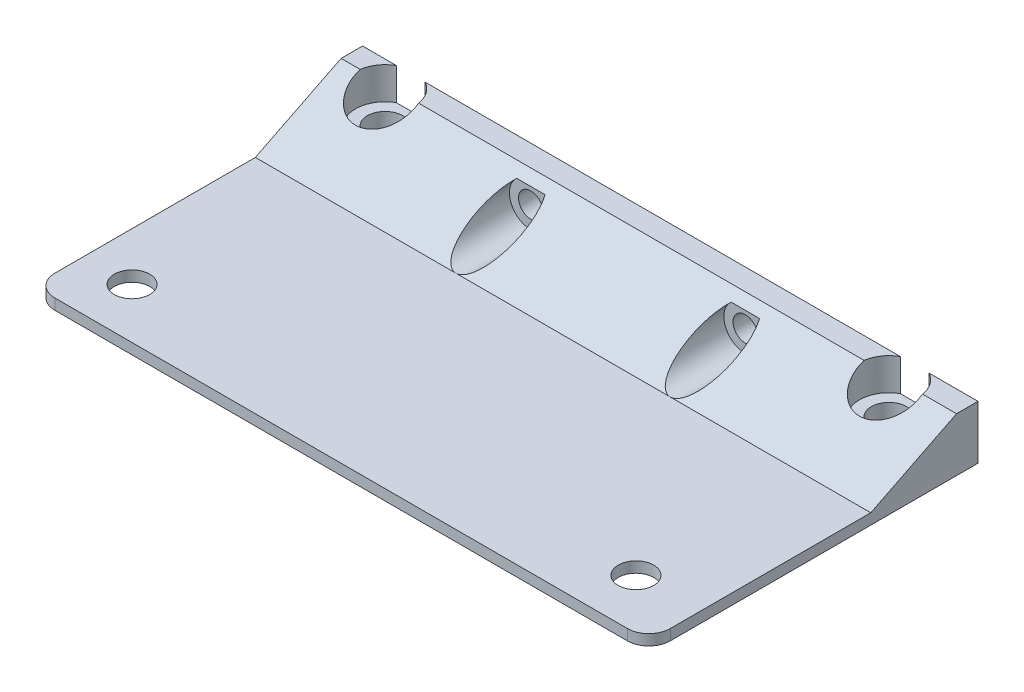
from build123d import *

# Parameters (mm, degrees)
SKETCH1_W           = 57.4
SKETCH1_H           = 33
SKETCH1_R           = 1.65
BOSS_EXTRUDE1_DEPTH = 1
CUT_EXTRUDE1_REACH  = 68.218
SKETCH2_W           = 57.4
SKETCH2_H           = 2.3
BOSS_EXTRUDE2_DEPTH = 57.4
FILLET1_R           = 2
SKETCH4_R           = 1.65
CUT_EXTRUDE2_DEPTH  = 2
CUT_EXTRUDE3_REACH  = 67.163
SKETCH5_R           = 2.75
SKETCH6_R           = 1.15
CUT_EXTRUDE4_DEPTH  = 3
SKETCH9_R           = 2
CUT_EXTRUDE5_DEPTH  = 64.930039887


with BuildPart() as part:
    # Sketch1 → Boss-Extrude1 (new body)
    with BuildSketch(Plane(origin=(0, 0, 0), x_dir=(1, 0, 0), z_dir=(0, 1, 0))):
        with Locations((28.7, 16.5)):
            Rectangle(SKETCH1_W, SKETCH1_H)
        with Locations(Location((4.5, 28.3, 0), (0, 0, 270))):
            Circle(SKETCH1_R, mode=Mode.SUBTRACT)
        with Locations(Location((51.5, 28.3, 0), (0, 0, 270))):
            Circle(SKETCH1_R, mode=Mode.SUBTRACT)
        with Locations(Location((4.5, 4.7, 0), (0, 0, 270))):
            Circle(SKETCH1_R, mode=Mode.SUBTRACT)
        with Locations(Location((51.5, 4.7, 0), (0, 0, 270))):
            Circle(SKETCH1_R, mode=Mode.SUBTRACT)
    extrude(amount=BOSS_EXTRUDE1_DEPTH)

    # Sketch2 → Cut-Extrude1 (cut, up to next)
    with BuildSketch(Plane(origin=(0, 1, 0), x_dir=(1, 0, 0), z_dir=(0, 1, 0)), mode=Mode.PRIVATE) as cut_extrude1_sk1:
        with Locations((28.7, 31.85)):
            Rectangle(SKETCH2_W, SKETCH2_H)
    cut_extrude1_tool1 = extrude(cut_extrude1_sk1.sketch, amount=-CUT_EXTRUDE1_REACH, mode=Mode.PRIVATE) & part.part
    add(cut_extrude1_tool1.solids().sort_by_distance((28.7, 1, -31.85))[0], mode=Mode.SUBTRACT)

    # Sketch3 → Boss-Extrude2 (add)
    with BuildSketch(Plane(origin=(57.4, 0, 0), x_dir=(0, 0, -1), z_dir=(1, 0, 0))):
        Polygon((30.7, 1), (30.7, 5), (28.7, 5), (20.7, 1), align=None)
    extrude(amount=-BOSS_EXTRUDE2_DEPTH)

    # Fillet1
    fillet1_edges = [part.edges().sort_by_distance(p)[0] for p in [
        (57.4, 0.5, 0),
        (0, 0.5, 0),
    ]]
    fillet(fillet1_edges, radius=FILLET1_R)

    # Sketch4 → Cut-Extrude2 (cut)
    with BuildSketch(Plane(origin=(0, 0, 0), x_dir=(-1, 0, 0), z_dir=(0, -1, 0))):
        with Locations(Location((-4.5, 28.3, 0), (0, 0, 90))):
            Circle(SKETCH4_R)
        with Locations(Location((-51.5, 28.3, 0), (0, 0, 90))):
            Circle(SKETCH4_R)
    extrude(amount=-CUT_EXTRUDE2_DEPTH, mode=Mode.SUBTRACT)

    # Sketch5 → Cut-Extrude3 (cut, up to next)
    with BuildSketch(Plane(origin=(0, 2, 0), x_dir=(-1, 0, 0), z_dir=(0, -1, 0)), mode=Mode.PRIVATE) as cut_extrude3_sk1:
        with Locations((-4.5, 28.3)):
            Circle(SKETCH5_R)
    cut_extrude3_tool1 = extrude(cut_extrude3_sk1.sketch, amount=-CUT_EXTRUDE3_REACH, mode=Mode.PRIVATE) & part.part
    # Sketch5 → Cut-Extrude3 (cut, up to next)
    with BuildSketch(Plane(origin=(0, 2, 0), x_dir=(-1, 0, 0), z_dir=(0, -1, 0)), mode=Mode.PRIVATE) as cut_extrude3_sk2:
        with Locations((-51.5, 28.3)):
            Circle(SKETCH5_R)
    cut_extrude3_tool2 = extrude(cut_extrude3_sk2.sketch, amount=-CUT_EXTRUDE3_REACH, mode=Mode.PRIVATE) & part.part
    add(cut_extrude3_tool1.solids().sort_by_distance((4.5, 2, -28.3))[0], mode=Mode.SUBTRACT)
    add(cut_extrude3_tool2.solids().sort_by_distance((51.5, 2, -28.3))[0], mode=Mode.SUBTRACT)

    # Sketch6 → Cut-Extrude4 (cut)
    with BuildSketch(Plane(origin=(0, 0, -30.7), x_dir=(-1, 0, 0), z_dir=(0, 0, -1))):
        with Locations((-38.7, 3)):
            Circle(SKETCH6_R)
        with Locations((-18.7, 3)):
            Circle(SKETCH6_R)
    extrude(amount=-CUT_EXTRUDE4_DEPTH, mode=Mode.SUBTRACT)

    # Sketch9 → Cut-Extrude5 (cut, through all)
    with BuildSketch(Plane(origin=(0, 0, -27.7), x_dir=(-1, 0, 0), z_dir=(0, 0, -1))):
        with Locations((-38.7, 3)):
            Circle(SKETCH9_R)
        with Locations((-18.7, 3)):
            Circle(SKETCH9_R)
    extrude(amount=-CUT_EXTRUDE5_DEPTH, mode=Mode.SUBTRACT)


solid = part.part
